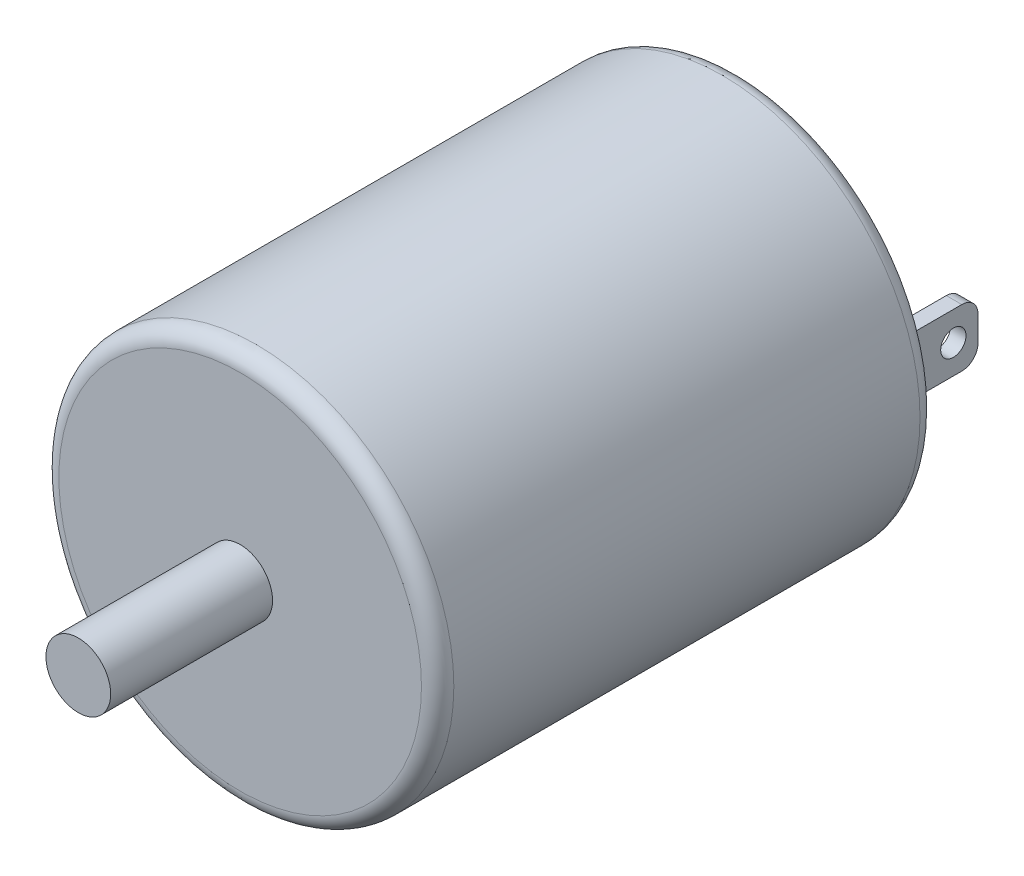
from build123d import *

# Parameters (mm, degrees)
ESBO_O1_R                = 12.2
RESSALTO_EXTRUS_O1_DEPTH = 30.8
FILETE1_R                = 1
ESBO_O2_R                = 2
RESSALTO_EXTRUS_O2_DEPTH = 10
ESBO_O4_W                = 0.958903526
ESBO_O4_H                = 3.564219336
ESBO_O4_W_2              = 0.894406544
RESSALTO_EXTRUS_O3_DEPTH = 5
FILETE2_R                = 1
ESBO_O5_R                = 0.782109668
CORTE_EXTRUS_O2_DEPTH    = 48.924150269


with BuildPart() as part:
    # Esboço1 → Ressalto-extrusão1 (new body)
    with BuildSketch(Plane.XY):
        with Locations(Location((0, 0, 0), (0, 0, 180))):
            Circle(ESBO_O1_R)
    extrude(amount=RESSALTO_EXTRUS_O1_DEPTH)

    # Filete1
    filete1_edges = [part.edges().sort_by_distance(p)[0] for p in [
        (12.2, 0, 0),
        (12.2, 0, 30.8),
    ]]
    fillet(filete1_edges, radius=FILETE1_R)

    # Esboço2 → Ressalto-extrusão2 (add)
    with BuildSketch(Plane.XY.offset(30.8)):
        Circle(ESBO_O2_R)
    extrude(amount=RESSALTO_EXTRUS_O2_DEPTH)

    # Esboço4 → Ressalto-extrusão3 (add)
    with BuildSketch(Plane(origin=(0, 0, 0), x_dir=(-1, 0, 0), z_dir=(0, 0, -1))):
        with Locations((-9.303363775, 0.548104497)):
            Rectangle(ESBO_O4_W, ESBO_O4_H)
        with Locations((8.369776419, 0.548104497)):
            Rectangle(ESBO_O4_W_2, ESBO_O4_H)
    extrude(amount=RESSALTO_EXTRUS_O3_DEPTH)

    # Filete2
    filete2_edges = [part.edges().sort_by_distance(p)[0] for p in [
        (9.303363775, -1.234005171, -5),
        (9.303363775, 2.330214165, -5),
        (-8.369776419, 2.330214165, -5),
        (-8.369776419, -1.234005171, -5),
    ]]
    fillet(filete2_edges, radius=FILETE2_R)

    # Esboço5 → Corte-extrusão2 (cut, through all)
    with BuildSketch(Plane(origin=(9.782815538, 0, 0), x_dir=(0, 0, -1), z_dir=(1, 0, 0))):
        with Locations((3.47716986, 0.548104497)):
            Circle(ESBO_O5_R)
    extrude(amount=-CORTE_EXTRUS_O2_DEPTH, mode=Mode.SUBTRACT)


solid = part.part
